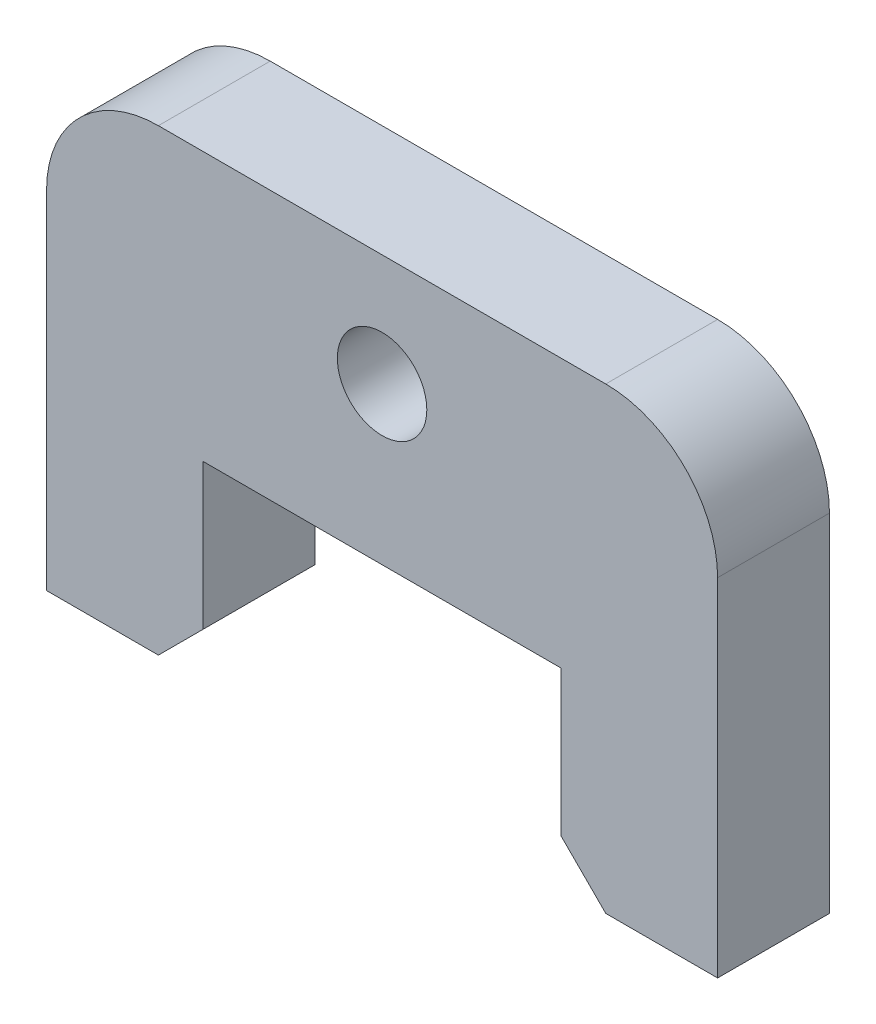
from build123d import *

# Parameters (mm, degrees)
SKETCH1_R           = 4
BOSS_EXTRUDE1_DEPTH = 10
SKETCH2_R           = 2.5
CUT_EXTRUDE1_DEPTH  = 8
SKETCH3_R           = 2.5
CUT_EXTRUDE2_DEPTH  = 8


with BuildPart() as part:
    # Sketch1 → Boss-Extrude1 (new body)
    with BuildSketch(Plane.XY):
        with BuildLine():
            Line((0, 0), (0, 31))
            ThreePointArc((0, 31), (2.928932188, 38.071067812), (10, 41))
            Line((10, 41), (50.004448763, 41))
            ThreePointArc((50.004448763, 41), (57.075516575, 38.071067812), (60.004448763, 31))
            Line((60.004448763, 31), (60.004448763, 0))
            Line((60.004448763, 0), (50.004448763, 0))
            Line((50.004448763, 0), (46.002224382, 4.002224382))
            Line((46.002224382, 4.002224382), (46.002224382, 17))
            Line((46.002224382, 17), (14.002224382, 17))
            Line((14.002224382, 17), (14.002224382, 4.002224382))
            Line((14.002224382, 4.002224382), (10, 0))
            Line((10, 0), (0, 0))
        make_face()
        with Locations((30.002224382, 31)):
            Circle(SKETCH1_R, mode=Mode.SUBTRACT)
    extrude(amount=BOSS_EXTRUDE1_DEPTH)

    # Sketch2 → Cut-Extrude1 (cut)
    with BuildSketch(Plane.XZ):
        with Locations(Location((55.004448763, 5, 0), (0, 0, 270))):
            Circle(SKETCH2_R)
    extrude(amount=-CUT_EXTRUDE1_DEPTH, mode=Mode.SUBTRACT)

    # Sketch3 → Cut-Extrude2 (cut)
    with BuildSketch(Plane.XZ):
        with Locations(Location((5, 5, 0), (0, 0, 270))):
            Circle(SKETCH3_R)
    extrude(amount=-CUT_EXTRUDE2_DEPTH, mode=Mode.SUBTRACT)


solid = part.part
